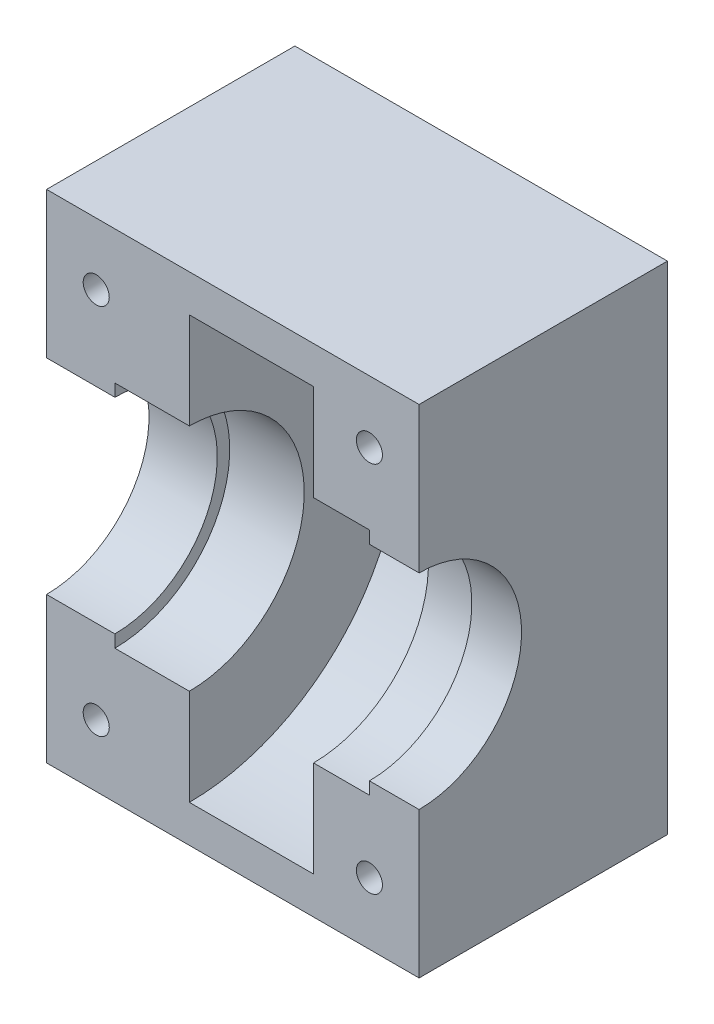
from build123d import *

# Parameters (mm, degrees)
SCHIZZO1_W                   = 60
SCHIZZO1_H                   = 80
ESTRUSIONE_ESTRUSIONE1_DEPTH = 40
SCHIZZO3_R                   = 16.5
TAGLIO_ESTRUSIONE1_DEPTH     = 11
SCHIZZO4_R                   = 18.5
TAGLIO_ESTRUSIONE2_DEPTH     = 12
SCHIZZO5_R                   = 34
TAGLIO_ESTRUSIONE3_DEPTH     = 20
SCHIZZO6_R                   = 18.5
TAGLIO_ESTRUSIONE4_DEPTH     = 9
SCHIZZO7_R                   = 16.5
TAGLIO_ESTRUSIONE5_DEPTH     = 8


with BuildPart() as part:
    # Schizzo1 → Estrusione-Estrusione1 (new body)
    with BuildSketch(Plane.XY):
        Rectangle(SCHIZZO1_W, SCHIZZO1_H)
    extrude(amount=ESTRUSIONE_ESTRUSIONE1_DEPTH)

    # Schizzo3 → Taglio-Estrusione1 (cut)
    with BuildSketch(Plane.ZY.offset(30)):
        with Locations((40, 0)):
            Circle(SCHIZZO3_R)
    extrude(amount=-TAGLIO_ESTRUSIONE1_DEPTH, mode=Mode.SUBTRACT)

    # Schizzo4 → Taglio-Estrusione2 (cut)
    with BuildSketch(Plane.ZY.offset(19)):
        with Locations((40, 0)):
            Circle(SCHIZZO4_R)
    extrude(amount=-TAGLIO_ESTRUSIONE2_DEPTH, mode=Mode.SUBTRACT)

    # Schizzo5 → Taglio-Estrusione3 (cut)
    with BuildSketch(Plane.ZY.offset(7)):
        with Locations((40, 0)):
            Circle(SCHIZZO5_R)
    extrude(amount=-TAGLIO_ESTRUSIONE3_DEPTH, mode=Mode.SUBTRACT)

    # Schizzo6 → Taglio-Estrusione4 (cut)
    with BuildSketch(Plane.ZY.offset(-13)):
        with Locations((40, 0)):
            Circle(SCHIZZO6_R)
    extrude(amount=-TAGLIO_ESTRUSIONE4_DEPTH, mode=Mode.SUBTRACT)

    # Schizzo7 → Taglio-Estrusione5 (cut)
    with BuildSketch(Plane.ZY.offset(-22)):
        with Locations((40, 0)):
            Circle(SCHIZZO7_R)
    extrude(amount=-TAGLIO_ESTRUSIONE5_DEPTH, mode=Mode.SUBTRACT)

    # Schizzo9 → Foro filettato M5-1 (revolve, cut)
    with BuildSketch(Plane(origin=(-22, 30, 40), x_dir=(0, -1, 0), z_dir=(1, 0, 0))):
        Polygon((0, 0), (0, 15.2618073), (2.1, 14), (2.1, 0), align=None)
    foro_filettato_m5_1 = revolve(axis=Axis((-22, 30, 46.35), (0, 0, -1)), mode=Mode.SUBTRACT)

    # Specchia1: Foro filettato M5-1 across plane
    add(foro_filettato_m5_1.mirror(Plane.ZX), mode=Mode.SUBTRACT)

    # Specchia2: Foro filettato M5-1 across plane
    add(foro_filettato_m5_1.mirror(Plane(origin=(0, 0, 0), x_dir=(0, 0, 1), z_dir=(1, 0, 0))), mode=Mode.SUBTRACT)

    # Specchia2 copy 1 sketch → Specchia2 copy 1 (revolve, cut)
    with BuildSketch(Plane(origin=(22, -30, 40), x_dir=(0, 1, 0), z_dir=(-1, 0, 0))):
        Polygon((0, 0), (0, 15.2618073), (2.1, 14), (2.1, 0), align=None)
    revolve(axis=Axis((22, -30, 46.35), (0, 0, -1)), mode=Mode.SUBTRACT)


solid = part.part
